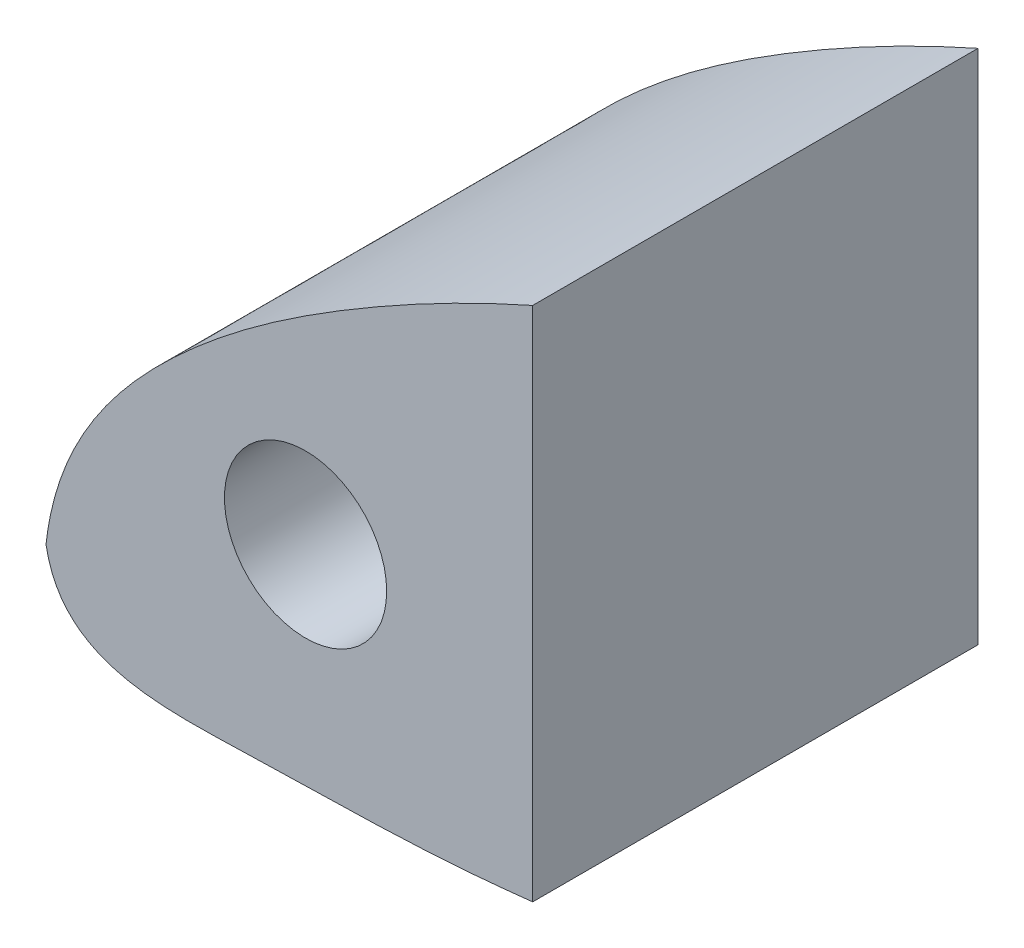
from build123d import *

# Parameters (mm, degrees)
BOSS_EXTRUDE1_DEPTH = 34.8615
SKETCH2_R           = 6.35
SKETCH2_R_2         = 3.175
CUT_EXTRUDE1_DEPTH  = 318.646799811
SKETCH3_W           = 293.188888759
SKETCH3_H           = 137.971241769
CUT_EXTRUDE2_DEPTH  = 318.646799811


with BuildPart() as part:
    # Sketch1 → Boss-Extrude1 (new body)
    with BuildSketch(Plane.XY):
        with BuildLine():
            add(Edge.make_bspline(
                [(0.000560351, 0.000130087), (0.810633127, 7.359196055), (8.649092025, 17.856605174), (26.286719818, 29.975176328), (52.111128271, 42.069215275), (89.597618475, 49.290763054), (131.400792109, 47.884831915), (173.256699242, 40.041104278), (217.961060472, 29.612974894), (256.952064401, 19.528920948), (290.35983767, 8.71099439), (301.273197721, 4.382828139), (314.816918223, -0.516206742), (309.846313895, 0.000130087)],
                knots=[0, 0, 0, 0, 0.060863618, 0.113688265, 0.188608742, 0.312908923, 0.448482434, 0.557612135, 0.691544113, 0.852438279, 0.92975597, 0.976058229, 1, 1, 1, 1], degree=3))
            add(Edge.make_bspline(
                [(309.846313895, 0.000130087), (303.956832565, 1.47095521), (293.989507544, 2.093987313), (276.26402299, 4.514356704), (260.846344817, 5.427413394), (235.858814759, 7.870306192), (205.101424636, 8.838080282), (157.718638092, 9.030650149), (110.497331172, 6.181495223), (66.506197185, -0.586669107), (36.454672816, -6.098499901), (15.316603331, -6.189065841), (1.230714189, -6.924076091), (0.000560351, 0.000130087)],
                knots=[0, 0, 0, 0, 0.057787081, 0.095274891, 0.171021118, 0.205339302, 0.335319146, 0.464904334, 0.658702312, 0.785511947, 0.893517288, 0.94309214, 1, 1, 1, 1], degree=3))
        make_face()
    extrude(amount=BOSS_EXTRUDE1_DEPTH)

    # Sketch2 → Cut-Extrude1 (cut, through all)
    with BuildSketch(Plane.XY.offset(34.8615)):
        with Locations((20.32, 10.16)):
            Circle(SKETCH2_R)
        with Locations((227.296313895, 19.050130087)):
            Circle(SKETCH2_R_2)
    extrude(amount=-CUT_EXTRUDE1_DEPTH, mode=Mode.SUBTRACT)

    # Sketch3 → Cut-Extrude2 (cut, through all)
    with BuildSketch(Plane.XY.offset(34.8615)):
        with Locations((184.69444438, 2.732377951)):
            Rectangle(SKETCH3_W, SKETCH3_H)
    extrude(amount=-CUT_EXTRUDE2_DEPTH, mode=Mode.SUBTRACT)


solid = part.part
